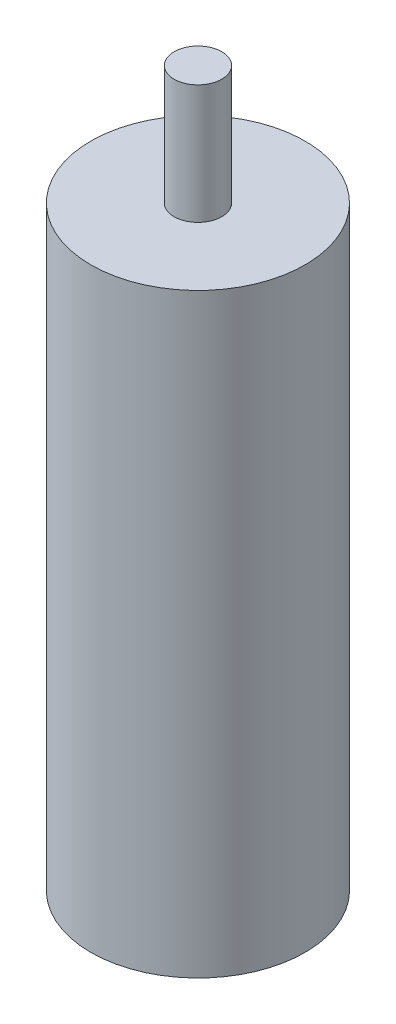
from build123d import *

# Parameters (mm, degrees)
SKETCH1_R           = 22.5
BOSS_EXTRUDE1_DEPTH = 125
SKETCH2_R           = 5
BOSS_EXTRUDE2_DEPTH = 25


with BuildPart() as part:
    # Sketch1 → Boss-Extrude1 (new body)
    with BuildSketch(Plane(origin=(0, 0, 0), x_dir=(1, 0, 0), z_dir=(0, 1, 0))):
        with Locations(Location((0, 0, 0), (0, 0, 270))):
            Circle(SKETCH1_R)
    extrude(amount=BOSS_EXTRUDE1_DEPTH)

    # Sketch2 → Boss-Extrude2 (add)
    with BuildSketch(Plane(origin=(0, 125, 0), x_dir=(1, 0, 0), z_dir=(0, 1, 0))):
        with Locations(Location((0, 0, 0), (0, 0, 270))):
            Circle(SKETCH2_R)
    extrude(amount=BOSS_EXTRUDE2_DEPTH)


solid = part.part
